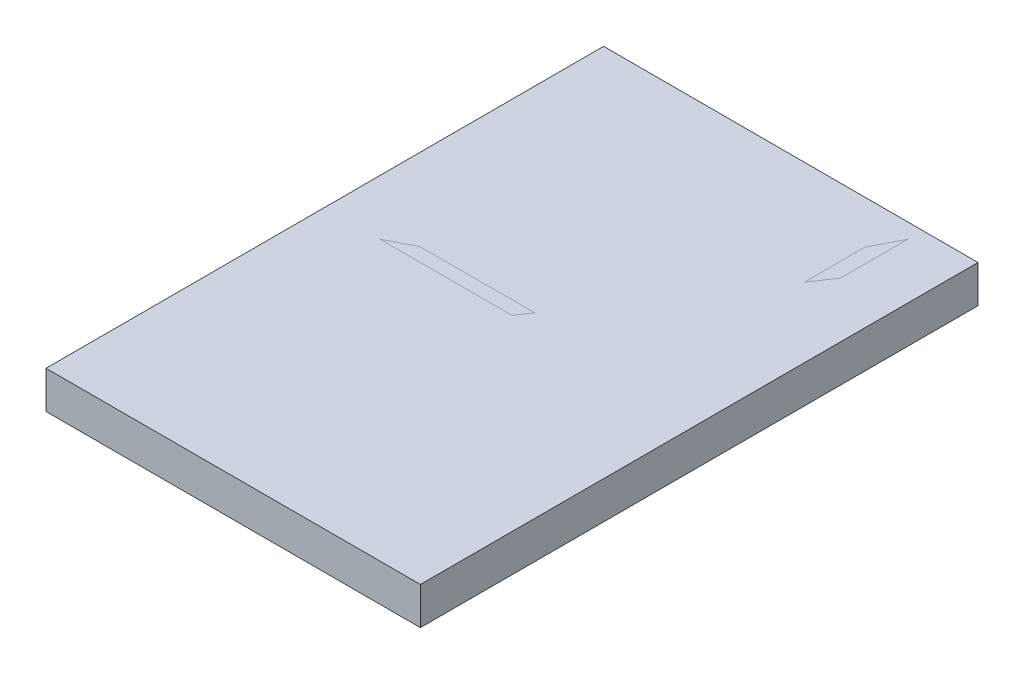
from build123d import *

# Parameters (mm, degrees)
SKETCH1_W           = 56.4
SKETCH1_H           = 142.8
BOSS_EXTRUDE1_DEPTH = 8
SKETCH2_R           = 16
CUT_EXTRUDE1_DEPTH  = 6
SKETCH3_R           = 10
CUT_EXTRUDE2_DEPTH  = 154.651553848
SKETCH4_R           = 2
CUT_EXTRUDE3_DEPTH  = 154.7426421
FILLET2_R           = 3
SKETCH6_W           = 80
SKETCH6_H           = 119.15
BOSS_EXTRUDE2_DEPTH = 8
SKETCH9_R           = 2
CUT_EXTRUDE5_DEPTH  = 10


with BuildPart() as part:
    # Sketch1 → Boss-Extrude1 (new body)
    with BuildSketch(Plane(origin=(0, 0, 0), x_dir=(1, 0, 0), z_dir=(0, 1, 0))):
        with Locations((28.2, -71.4)):
            Rectangle(SKETCH1_W, SKETCH1_H)
    extrude(amount=BOSS_EXTRUDE1_DEPTH)

    # Sketch2 → Cut-Extrude1 (cut)
    with BuildSketch(Plane(origin=(0, 8, 0), x_dir=(1, 0, 0), z_dir=(0, 1, 0))):
        with Locations(Location((28.2, -43.2, 0), (0, 0, 270))):
            Circle(SKETCH2_R)
    extrude(amount=-CUT_EXTRUDE1_DEPTH, mode=Mode.SUBTRACT)

    # Sketch3 → Cut-Extrude2 (cut, through all)
    with BuildSketch(Plane(origin=(0, 2, 0), x_dir=(1, 0, 0), z_dir=(0, 1, 0))):
        with Locations(Location((28.2, -43.2, 0), (0, 0, 270))):
            Circle(SKETCH3_R)
    extrude(amount=-CUT_EXTRUDE2_DEPTH, mode=Mode.SUBTRACT)

    # Sketch4 → Cut-Extrude3 (cut, through all)
    with BuildSketch(Plane(origin=(0, 8, 0), x_dir=(1, 0, 0), z_dir=(0, 1, 0))):
        with Locations(Location((4.58, -19.58, 0), (0, 0, 270))):
            Circle(SKETCH4_R)
        with Locations(Location((51.82, -19.58, 0), (0, 0, 90))):
            Circle(SKETCH4_R)
        with Locations(Location((51.82, -66.82, 0), (0, 0, 270))):
            Circle(SKETCH4_R)
        with Locations(Location((4.58, -66.82, 0), (0, 0, 90))):
            Circle(SKETCH4_R)
    cut_extrude3 = extrude(amount=-CUT_EXTRUDE3_DEPTH, mode=Mode.SUBTRACT)

    # Mirror1: Cut-Extrude3 across plane
    add(cut_extrude3.mirror(Plane.XY.offset(71.4)), mode=Mode.SUBTRACT)

    # Fillet2
    fillet2_edges = [part.edges().sort_by_distance(p)[0] for p in [
        (0, 4, 0),
        (56.4, 4, 0),
        (56.4, 4, 142.8),
        (0, 4, 142.8),
    ]]
    fillet(fillet2_edges, radius=FILLET2_R)

    # Sketch9 → Cut-Extrude5 (cut)
    with BuildSketch(Plane(origin=(0, 8, 0), x_dir=(1, 0, 0), z_dir=(0, 1, 0))):
        with Locations(Location((7.5, -7.5, 0), (0, 0, 270))):
            Circle(SKETCH9_R)
        with Locations(Location((28.2, -7.5, 0), (0, 0, 270))):
            Circle(SKETCH9_R)
        with Locations(Location((48.9, -7.5, 0), (0, 0, 270))):
            Circle(SKETCH9_R)
    cut_extrude5 = extrude(amount=-CUT_EXTRUDE5_DEPTH, mode=Mode.SUBTRACT)

    # Mirror2: Cut-Extrude5 across plane
    add(cut_extrude5.mirror(Plane.XY.offset(71.4)), mode=Mode.SUBTRACT)

    # SurfaceCut1
    split(bisect_by=Plane.XY.offset(71.4), keep=Keep.BOTTOM)

    # SurfaceCut2
    split(bisect_by=Plane.XY.offset(15), keep=Keep.TOP)


with BuildPart() as body_2:
    # Sketch6 → Boss-Extrude2 (new body)
    with BuildSketch(Plane(origin=(0, 8, 0), x_dir=(1, 0, 0), z_dir=(0, 1, 0))):
        with Locations((28.2, -71.4)):
            Rectangle(SKETCH6_W, SKETCH6_H)
    extrude(amount=-BOSS_EXTRUDE2_DEPTH)


solid = Compound([part.part, body_2.part])
